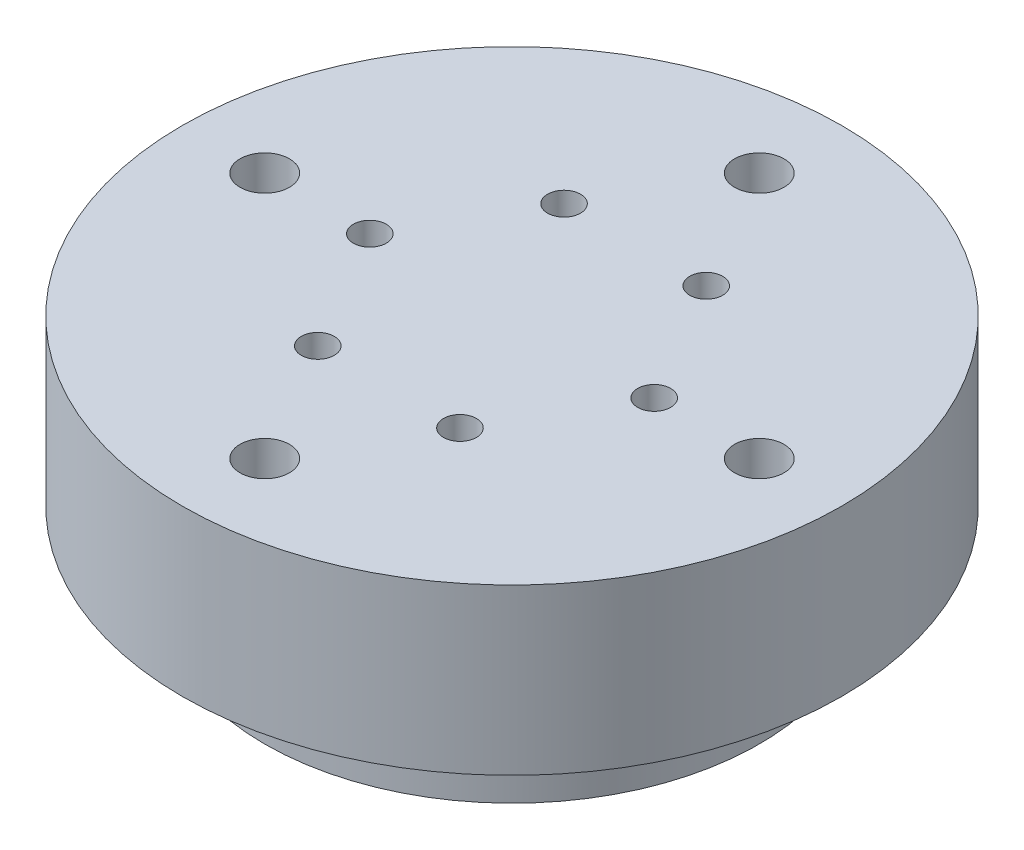
from build123d import *
from build123d.topology import SkipClean

# Parameters (mm, degrees)
SKETCH_1_R          = 30
SKETCH_1_R_2        = 3
EXTRUDE_1_DEPTH     = 30
EXTRUDE_START       = -20
SKETCH_2_R          = 40
EXTRUDE_2_DEPTH     = 20
CUT_EXTRUDE_START   = -20
CUT_EXTRUDE_1_DEPTH = 20
EXTRUDE_START_2     = -30
SKETCH_4_R          = 3
SKETCH_4_R_2        = 2
EXTRUDE_4_DEPTH     = 30


with BuildPart() as part:
    # 草图1 → 凸台-拉伸1 (new body)
    with BuildSketch(Plane(origin=(0, 0, 0), x_dir=(1, 0, 0), z_dir=(0, 1, 0))):
        with Locations(Location((0, 0, 0), (0, 0, 270))):
            Circle(SKETCH_1_R)
        with Locations(Location((-17.25, 0, 0), (0, 0, 270))):
            Circle(SKETCH_1_R_2, mode=Mode.SUBTRACT)
        with Locations(Location((-8.625, 14.938938215, 0), (0, 0, 270))):
            Circle(SKETCH_1_R_2, mode=Mode.SUBTRACT)
        with Locations(Location((8.625, 14.938938215, 0), (0, 0, 270))):
            Circle(SKETCH_1_R_2, mode=Mode.SUBTRACT)
        with Locations(Location((17.25, 0, 0), (0, 0, 270))):
            Circle(SKETCH_1_R_2, mode=Mode.SUBTRACT)
        with Locations(Location((8.625, -14.938938215, 0), (0, 0, 270))):
            Circle(SKETCH_1_R_2, mode=Mode.SUBTRACT)
        with Locations(Location((-8.625, -14.938938215, 0), (0, 0, 270))):
            Circle(SKETCH_1_R_2, mode=Mode.SUBTRACT)
    extrude(amount=EXTRUDE_1_DEPTH)

    # 草图2 → 凸台-拉伸2 (add)
    with BuildSketch(Plane(origin=(0, 30, 0), x_dir=(1, 0, 0), z_dir=(0, 1, 0)).offset(EXTRUDE_START)):
        with Locations(Location((0, 0, 0), (0, 0, 270))):
            Circle(SKETCH_2_R)
        with BuildLine():
            ThreePointArc((2.996247653, 29.85), (21.213203436, 21.213203436), (29.85, 2.996247653))
            ThreePointArc((29.85, 2.996247653), (32.067607313, 2.173706512), (33, 0))
            ThreePointArc((33, 0), (32.067607313, -2.173706512), (29.85, -2.996247653))
            ThreePointArc((29.85, -2.996247653), (21.213203436, -21.213203436), (2.996247653, -29.85))
            ThreePointArc((2.996247653, -29.85), (2.999061767, -29.924976537), (3, -30))
            ThreePointArc((3, -30), (-0.075023463, -32.999061767), (-2.996247653, -29.85))
            ThreePointArc((-2.996247653, -29.85), (-21.213203436, -21.213203436), (-29.85, -2.996247653))
            ThreePointArc((-29.85, -2.996247653), (-33, 0), (-29.85, 2.996247653))
            ThreePointArc((-29.85, 2.996247653), (-21.213203436, 21.213203436), (-2.996247653, 29.85))
            ThreePointArc((-2.996247653, 29.85), (-0.075023463, 32.999061767), (3, 30))
            ThreePointArc((3, 30), (2.999061767, 29.924976537), (2.996247653, 29.85))
        make_face(mode=Mode.SUBTRACT)
    extrude(amount=EXTRUDE_2_DEPTH)

    # 草图3 → 切除-拉伸1 (cut)
    with SkipClean():  # the faces are left unmerged after this step: merging them gives an invalid solid
        with BuildSketch(Plane(origin=(0, 30, 0), x_dir=(1, 0, 0), z_dir=(0, 1, 0)).offset(CUT_EXTRUDE_START)):
            with BuildLine():
                ThreePointArc((29.85, -2.996247653), (29.962476533, -1.5), (30, 0))
                ThreePointArc((30, 0), (29.962476533, 1.5), (29.85, 2.996247653))
                ThreePointArc((29.85, 2.996247653), (27, 0), (29.85, -2.996247653))
            make_face()
            with BuildLine():
                ThreePointArc((29.85, 2.996247653), (29.962476533, 1.5), (30, 0))
                ThreePointArc((30, 0), (29.962476533, -1.5), (29.85, -2.996247653))
                ThreePointArc((29.85, -2.996247653), (32.067607313, -2.173706512), (33, 0))
                ThreePointArc((33, 0), (32.067607313, 2.173706512), (29.85, 2.996247653))
            make_face()
            with BuildLine():
                ThreePointArc((-2.996247653, 29.85), (0, 27), (2.996247653, 29.85))
                ThreePointArc((2.996247653, 29.85), (0, 30), (-2.996247653, 29.85))
            make_face()
            with BuildLine():
                ThreePointArc((-2.996247653, 29.85), (0, 30), (2.996247653, 29.85))
                ThreePointArc((2.996247653, 29.85), (2.999061767, 29.924976537), (3, 30))
                ThreePointArc((3, 30), (-0.075023463, 32.999061767), (-2.996247653, 29.85))
            make_face()
            with BuildLine():
                ThreePointArc((3, -30), (2.999061767, -29.924976537), (2.996247653, -29.85))
                ThreePointArc((2.996247653, -29.85), (0, -30), (-2.996247653, -29.85))
                ThreePointArc((-2.996247653, -29.85), (-0.075023463, -32.999061767), (3, -30))
            make_face()
            with BuildLine():
                ThreePointArc((-2.996247653, -29.85), (0, -30), (2.996247653, -29.85))
                ThreePointArc((2.996247653, -29.85), (0, -27), (-2.996247653, -29.85))
            make_face()
            with BuildLine():
                ThreePointArc((-27, 0), (-27.826293488, 2.067607313), (-29.85, 2.996247653))
                ThreePointArc((-29.85, 2.996247653), (-30, 0), (-29.85, -2.996247653))
                ThreePointArc((-29.85, -2.996247653), (-27.826293488, -2.067607313), (-27, 0))
            make_face()
            with BuildLine():
                ThreePointArc((-29.85, -2.996247653), (-30, 0), (-29.85, 2.996247653))
                ThreePointArc((-29.85, 2.996247653), (-33, 0), (-29.85, -2.996247653))
            make_face()
        extrude(amount=CUT_EXTRUDE_1_DEPTH, mode=Mode.SUBTRACT)

    # 草图4 → 凸台-拉伸4 (add)
    # profile 1 of 6: a face of its own
    with SkipClean():  # the faces are left unmerged after this step: merging them gives an invalid solid
        with BuildSketch(Plane(origin=(0, 30, 0), x_dir=(1, 0, 0), z_dir=(0, 1, 0)).offset(EXTRUDE_START_2)):
            with Locations((17.25, 0)):
                Circle(SKETCH_4_R)
            with Locations(Location((17.25, 0, 0), (0, 0, 270))):
                Circle(SKETCH_4_R_2, mode=Mode.SUBTRACT)
        # profile 2 of 6: a face of its own
        with BuildSketch(Plane(origin=(0, 30, 0), x_dir=(1, 0, 0), z_dir=(0, 1, 0)).offset(EXTRUDE_START_2)):
            with Locations((8.625, 14.938938215)):
                Circle(SKETCH_4_R)
            with Locations(Location((8.625, 14.938938215, 0), (0, 0, 270))):
                Circle(SKETCH_4_R_2, mode=Mode.SUBTRACT)
        # profile 3 of 6: a face of its own
        with BuildSketch(Plane(origin=(0, 30, 0), x_dir=(1, 0, 0), z_dir=(0, 1, 0)).offset(EXTRUDE_START_2)):
            with Locations((8.625, -14.938938215)):
                Circle(SKETCH_4_R)
            with Locations(Location((8.625, -14.938938215, 0), (0, 0, 270))):
                Circle(SKETCH_4_R_2, mode=Mode.SUBTRACT)
        # profile 4 of 6: a face of its own
        with BuildSketch(Plane(origin=(0, 30, 0), x_dir=(1, 0, 0), z_dir=(0, 1, 0)).offset(EXTRUDE_START_2)):
            with Locations((-8.625, 14.938938215)):
                Circle(SKETCH_4_R)
            with Locations(Location((-8.625, 14.938938215, 0), (0, 0, 270))):
                Circle(SKETCH_4_R_2, mode=Mode.SUBTRACT)
        # profile 5 of 6: a face of its own
        with BuildSketch(Plane(origin=(0, 30, 0), x_dir=(1, 0, 0), z_dir=(0, 1, 0)).offset(EXTRUDE_START_2)):
            with Locations((-8.625, -14.938938215)):
                Circle(SKETCH_4_R)
            with Locations(Location((-8.625, -14.938938215, 0), (0, 0, 270))):
                Circle(SKETCH_4_R_2, mode=Mode.SUBTRACT)
        # profile 6 of 6: a face of its own
        with BuildSketch(Plane(origin=(0, 30, 0), x_dir=(1, 0, 0), z_dir=(0, 1, 0)).offset(EXTRUDE_START_2)):
            with Locations((-17.25, 0)):
                Circle(SKETCH_4_R)
            with Locations(Location((-17.25, 0, 0), (0, 0, 270))):
                Circle(SKETCH_4_R_2, mode=Mode.SUBTRACT)
        extrude(amount=EXTRUDE_4_DEPTH)


solid = part.part
